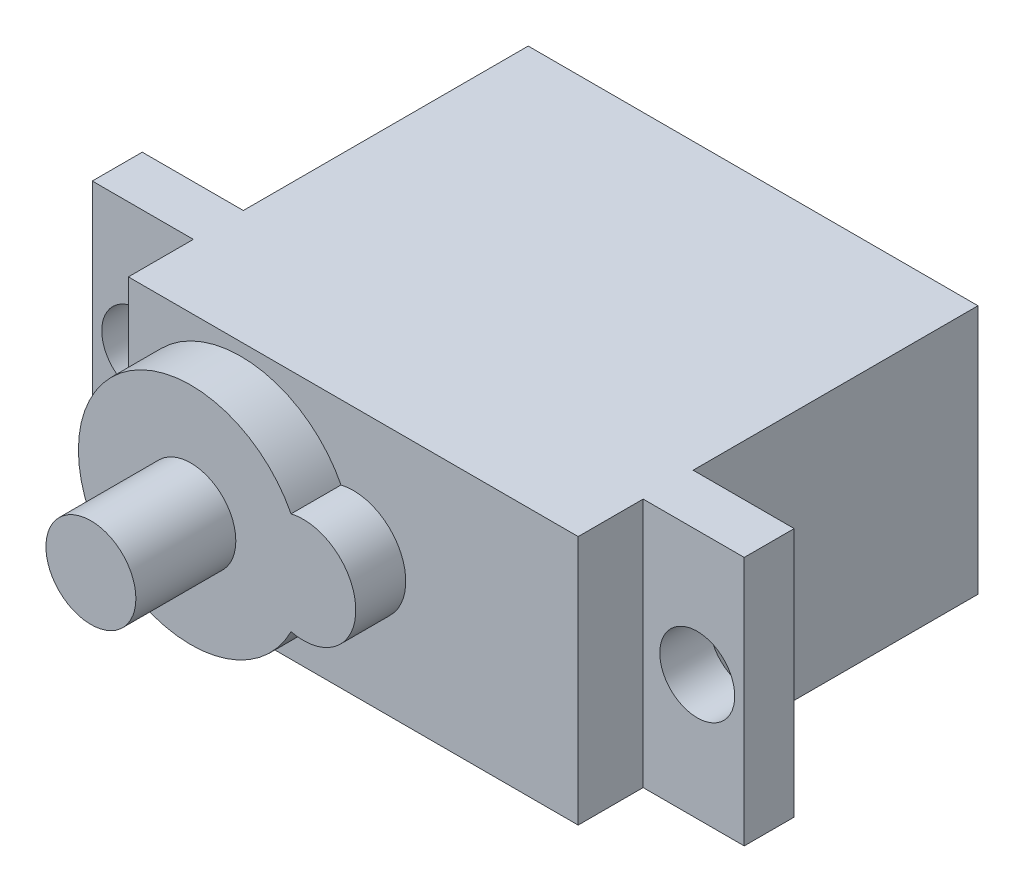
from build123d import *

# Parameters (mm, degrees)
BOSS_EXTRUDE1_DEPTH      = 3.302
BOSS_EXTRUDE1_DEPTH_BACK = 17.018
SKETCH2_W                = 22.86
SKETCH2_H                = 12.7
SKETCH2_5_W              = 5.136925293
SKETCH2_5_H              = 12.7
SKETCH2_5_R              = 1.905
BOSS_EXTRUDE2_DEPTH      = 2.54
BOSS_EXTRUDE3_DEPTH      = 2.54
SKETCH4_R                = 2.286
BOSS_EXTRUDE4_DEPTH      = 5.08


with BuildPart() as part:
    # Sketch2 → Boss-Extrude1 (new, two sides: drawn at the far end of the back side and taken through both)
    with BuildSketch(Plane.XY.offset(-BOSS_EXTRUDE1_DEPTH_BACK)):
        with Locations((-81.300738581, 60.932338755)):
            Rectangle(SKETCH2_W, SKETCH2_H)
    extrude(amount=BOSS_EXTRUDE1_DEPTH + BOSS_EXTRUDE1_DEPTH_BACK)

    # Sketch2<5> → Boss-Extrude2 (add)
    # profile 1 of 2: a face of its own
    with BuildSketch(Plane.XY):
        with Locations((-95.299201228, 60.932338755)):
            Rectangle(SKETCH2_5_W, SKETCH2_5_H)
        with Locations((-95.480738581, 60.932338755)):
            Circle(SKETCH2_5_R, mode=Mode.SUBTRACT)
    # profile 2 of 2: a face of its own
    with BuildSketch(Plane.XY):
        with Locations((-67.302275935, 60.932338755)):
            Rectangle(SKETCH2_5_W, SKETCH2_5_H)
        with Locations((-67.120738581, 60.932338755)):
            Circle(SKETCH2_5_R, mode=Mode.SUBTRACT)
    extrude(amount=-BOSS_EXTRUDE2_DEPTH)

    # Sketch3 → Boss-Extrude3 (add)
    with BuildSketch(Plane.XY.offset(3.302)):
        with BuildLine():
            ThreePointArc((-81.923038581, 63.525721047), (-92.730738581, 60.932338755), (-81.923038581, 58.338956464))
            ThreePointArc((-81.923038581, 58.338956464), (-78.633738581, 60.932338755), (-81.923038581, 63.525721047))
        make_face()
    extrude(amount=BOSS_EXTRUDE3_DEPTH)

    # Sketch4 → Boss-Extrude4 (add)
    with BuildSketch(Plane.XY.offset(5.842)):
        with Locations((-87.015738581, 60.932338755)):
            Circle(SKETCH4_R)
    extrude(amount=BOSS_EXTRUDE4_DEPTH)


solid = part.part
